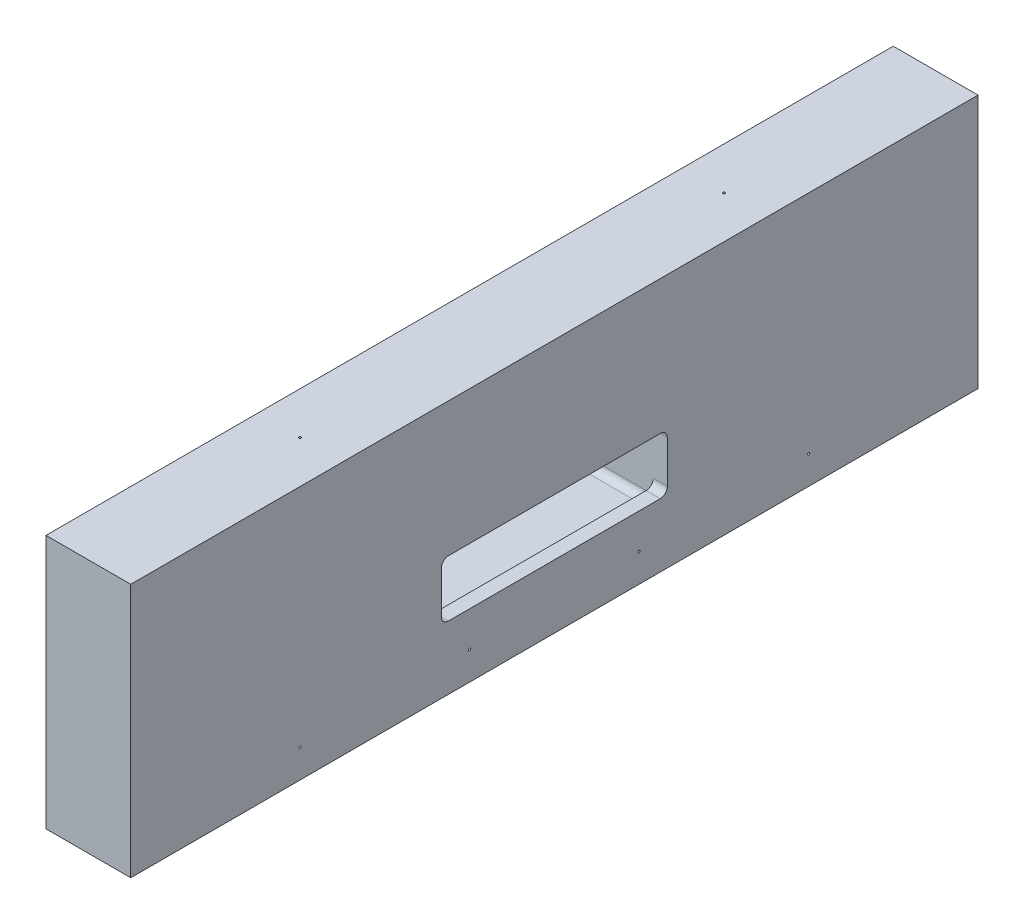
from build123d import *

# Parameters (mm, degrees)
SKETCH1_W           = 762
SKETCH1_H           = 228.6
BOSS_EXTRUDE1_DEPTH = 76.2
SKETCH2_W           = 203.2
SKETCH2_H           = 95.25
CUT_EXTRUDE1_DEPTH  = 63.5
SKETCH3_W           = 203.2
SKETCH3_H           = 50.8
CUT_EXTRUDE2_DEPTH  = 799.081581043
FILLET1_R           = 25.4
SKETCH4_R           = 1.016
CUT_EXTRUDE3_DEPTH  = 800.192342306
LPATTERN1_COUNT     = 4
LPATTERN1_PITCH     = 152.4
FILLET2_R           = 6.35
FILLET3_R           = 6.35
SKETCH6_R           = 1.016
CUT_EXTRUDE4_DEPTH  = 50.8


with BuildPart() as part:
    # Sketch1 → Boss-Extrude1 (new body)
    with BuildSketch(Plane(origin=(0, 0, 0), x_dir=(0, 0, -1), z_dir=(1, 0, 0))):
        with Locations((381, 114.3)):
            Rectangle(SKETCH1_W, SKETCH1_H)
    extrude(amount=BOSS_EXTRUDE1_DEPTH)

    # Sketch2 → Cut-Extrude1 (cut)
    with BuildSketch(Plane.ZY):
        with Locations((-381, 92.075)):
            Rectangle(SKETCH2_W, SKETCH2_H)
    extrude(amount=-CUT_EXTRUDE1_DEPTH, mode=Mode.SUBTRACT)

    # Sketch3 → Cut-Extrude2 (cut, through all)
    with BuildSketch(Plane.ZY.offset(-63.5)):
        with Locations((-381, 82.55)):
            Rectangle(SKETCH3_W, SKETCH3_H)
    extrude(amount=-CUT_EXTRUDE2_DEPTH, mode=Mode.SUBTRACT)

    # Fillet1
    fillet1_edges = [part.edges().sort_by_distance(p)[0] for p in [
        (31.75, 139.7, -482.6),
        (31.75, 139.7, -279.4),
    ]]
    fillet(fillet1_edges, radius=FILLET1_R)

    # Sketch4 → Cut-Extrude3 (cut, through all)
    with BuildSketch(Plane.ZY):
        with Locations((-609.6, 25.4)):
            Circle(SKETCH4_R)
    cut_extrude3 = extrude(amount=-CUT_EXTRUDE3_DEPTH, mode=Mode.SUBTRACT)

    # LPattern1: Cut-Extrude3 ×4
    with Locations(*[(0, 0, i * LPATTERN1_PITCH) for i in range(1, LPATTERN1_COUNT)]):
        add(cut_extrude3, mode=Mode.SUBTRACT)

    # Fillet2
    fillet2_edges = [part.edges().sort_by_distance(p)[0] for p in [
        (69.85, 57.15, -482.6),
        (69.85, 107.95, -482.6),
        (69.85, 107.95, -279.4),
        (69.85, 57.15, -279.4),
    ]]
    fillet(fillet2_edges, radius=FILLET2_R)

    # Fillet3
    fillet3_edges = [part.edges().sort_by_distance(p)[0] for p in [
        (31.75, 44.45, -482.6),
        (31.75, 44.45, -279.4),
    ]]
    fillet(fillet3_edges, radius=FILLET3_R)

    # Sketch6 → Cut-Extrude4 (cut)
    with BuildSketch(Plane(origin=(0, 228.6, 0), x_dir=(1, 0, 0), z_dir=(0, 1, 0))):
        with Locations(Location((38.1, 571.5, 0), (0, 0, 270))):
            Circle(SKETCH6_R)
        with Locations(Location((38.1, 190.5, 0), (0, 0, 270))):
            Circle(SKETCH6_R)
    extrude(amount=-CUT_EXTRUDE4_DEPTH, mode=Mode.SUBTRACT)


solid = part.part
